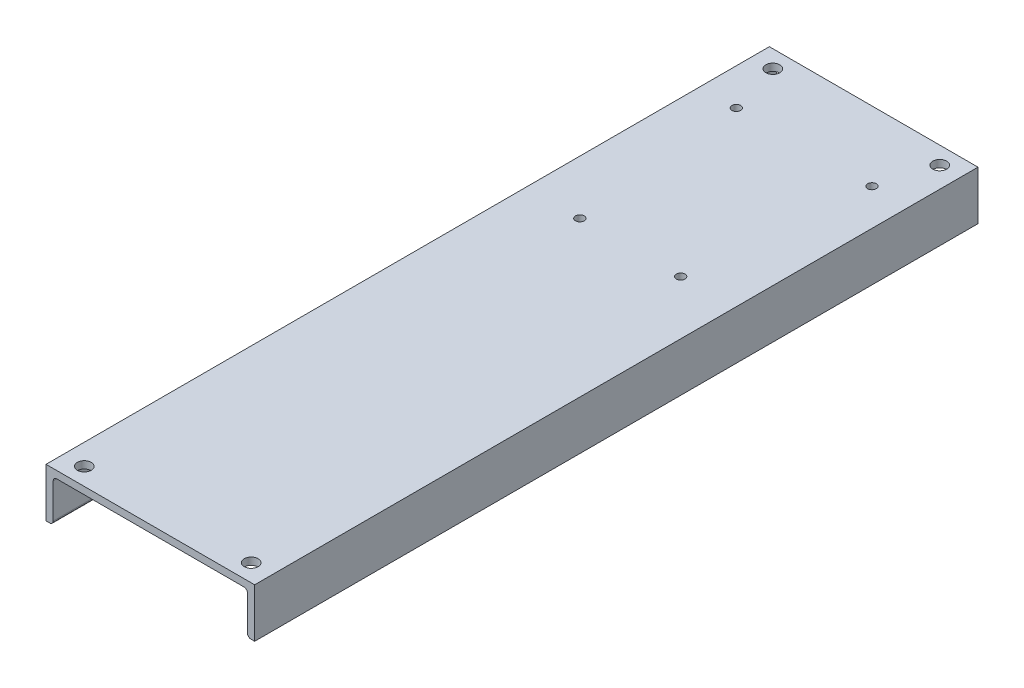
from build123d import *

# Parameters (mm, degrees)
BOSS_EXTRUDE1_DEPTH = 1320.8
FILLET1_R           = 6.35
CUT_EXTRUDE1_REACH  = 1379.559
SKETCH2_R           = 7.9375
CUT_EXTRUDE2_REACH  = 1379.559
SKETCH3_R           = 12.7


with BuildPart() as part:
    # Sketch1 → Boss-Extrude1 (new body)
    with BuildSketch(Plane.XY):
        Polygon((367.792, 0), (381, 0), (381, 89.408), (0, 89.408), (0, 0), (13.208, 0), (13.208, 76.2), (367.792, 76.2), align=None)
    extrude(amount=BOSS_EXTRUDE1_DEPTH)

    # Fillet1
    fillet1_edges = [part.edges().sort_by_distance(p)[0] for p in [
        (367.792, 0, 660.4),
        (367.792, 76.2, 660.4),
        (13.208, 76.2, 660.4),
        (13.208, 0, 660.4),
    ]]
    fillet(fillet1_edges, radius=FILLET1_R)

    # Sketch2 → Cut-Extrude1 (cut, up to next)
    with BuildSketch(Plane(origin=(0, 89.408, 0), x_dir=(1, 0, 0), z_dir=(0, 1, 0)), mode=Mode.PRIVATE) as cut_extrude1_sk1:
        with Locations(Location((66.675, -127, 0), (0, 0, 270))):
            Circle(SKETCH2_R)
    cut_extrude1_tool1 = extrude(cut_extrude1_sk1.sketch, amount=-CUT_EXTRUDE1_REACH, mode=Mode.PRIVATE) & part.part
    # Sketch2 → Cut-Extrude1 (cut, up to next)
    with BuildSketch(Plane(origin=(0, 89.408, 0), x_dir=(1, 0, 0), z_dir=(0, 1, 0)), mode=Mode.PRIVATE) as cut_extrude1_sk2:
        with Locations(Location((314.325, -127, 0), (0, 0, 270))):
            Circle(SKETCH2_R)
    cut_extrude1_tool2 = extrude(cut_extrude1_sk2.sketch, amount=-CUT_EXTRUDE1_REACH, mode=Mode.PRIVATE) & part.part
    # Sketch2 → Cut-Extrude1 (cut, up to next)
    with BuildSketch(Plane(origin=(0, 89.408, 0), x_dir=(1, 0, 0), z_dir=(0, 1, 0)), mode=Mode.PRIVATE) as cut_extrude1_sk3:
        with Locations(Location((98.425, -444.5, 0), (0, 0, 270))):
            Circle(SKETCH2_R)
    cut_extrude1_tool3 = extrude(cut_extrude1_sk3.sketch, amount=-CUT_EXTRUDE1_REACH, mode=Mode.PRIVATE) & part.part
    # Sketch2 → Cut-Extrude1 (cut, up to next)
    with BuildSketch(Plane(origin=(0, 89.408, 0), x_dir=(1, 0, 0), z_dir=(0, 1, 0)), mode=Mode.PRIVATE) as cut_extrude1_sk4:
        with Locations(Location((282.575, -444.5, 0), (0, 0, 270))):
            Circle(SKETCH2_R)
    cut_extrude1_tool4 = extrude(cut_extrude1_sk4.sketch, amount=-CUT_EXTRUDE1_REACH, mode=Mode.PRIVATE) & part.part
    add(cut_extrude1_tool1.solids().sort_by_distance((66.675, 89.408, 127))[0], mode=Mode.SUBTRACT)
    add(cut_extrude1_tool2.solids().sort_by_distance((314.325, 89.408, 127))[0], mode=Mode.SUBTRACT)
    add(cut_extrude1_tool3.solids().sort_by_distance((98.425, 89.408, 444.5))[0], mode=Mode.SUBTRACT)
    add(cut_extrude1_tool4.solids().sort_by_distance((282.575, 89.408, 444.5))[0], mode=Mode.SUBTRACT)

    # Sketch3 → Cut-Extrude2 (cut, up to next)
    with BuildSketch(Plane(origin=(0, 89.408, 0), x_dir=(1, 0, 0), z_dir=(0, 1, 0)), mode=Mode.PRIVATE) as cut_extrude2_sk1:
        with Locations(Location((38.1, -31.75, 0), (0, 0, 270))):
            Circle(SKETCH3_R)
    cut_extrude2_tool1 = extrude(cut_extrude2_sk1.sketch, amount=-CUT_EXTRUDE2_REACH, mode=Mode.PRIVATE) & part.part
    # Sketch3 → Cut-Extrude2 (cut, up to next)
    with BuildSketch(Plane(origin=(0, 89.408, 0), x_dir=(1, 0, 0), z_dir=(0, 1, 0)), mode=Mode.PRIVATE) as cut_extrude2_sk2:
        with Locations(Location((342.9, -31.75, 0), (0, 0, 270))):
            Circle(SKETCH3_R)
    cut_extrude2_tool2 = extrude(cut_extrude2_sk2.sketch, amount=-CUT_EXTRUDE2_REACH, mode=Mode.PRIVATE) & part.part
    # Sketch3 → Cut-Extrude2 (cut, up to next)
    with BuildSketch(Plane(origin=(0, 89.408, 0), x_dir=(1, 0, 0), z_dir=(0, 1, 0)), mode=Mode.PRIVATE) as cut_extrude2_sk3:
        with Locations(Location((38.1, -1289.05, 0), (0, 0, 270))):
            Circle(SKETCH3_R)
    cut_extrude2_tool3 = extrude(cut_extrude2_sk3.sketch, amount=-CUT_EXTRUDE2_REACH, mode=Mode.PRIVATE) & part.part
    # Sketch3 → Cut-Extrude2 (cut, up to next)
    with BuildSketch(Plane(origin=(0, 89.408, 0), x_dir=(1, 0, 0), z_dir=(0, 1, 0)), mode=Mode.PRIVATE) as cut_extrude2_sk4:
        with Locations(Location((342.9, -1289.05, 0), (0, 0, 270))):
            Circle(SKETCH3_R)
    cut_extrude2_tool4 = extrude(cut_extrude2_sk4.sketch, amount=-CUT_EXTRUDE2_REACH, mode=Mode.PRIVATE) & part.part
    add(cut_extrude2_tool1.solids().sort_by_distance((38.1, 89.408, 31.75))[0], mode=Mode.SUBTRACT)
    add(cut_extrude2_tool2.solids().sort_by_distance((342.9, 89.408, 31.75))[0], mode=Mode.SUBTRACT)
    add(cut_extrude2_tool3.solids().sort_by_distance((38.1, 89.408, 1289.05))[0], mode=Mode.SUBTRACT)
    add(cut_extrude2_tool4.solids().sort_by_distance((342.9, 89.408, 1289.05))[0], mode=Mode.SUBTRACT)


solid = part.part
